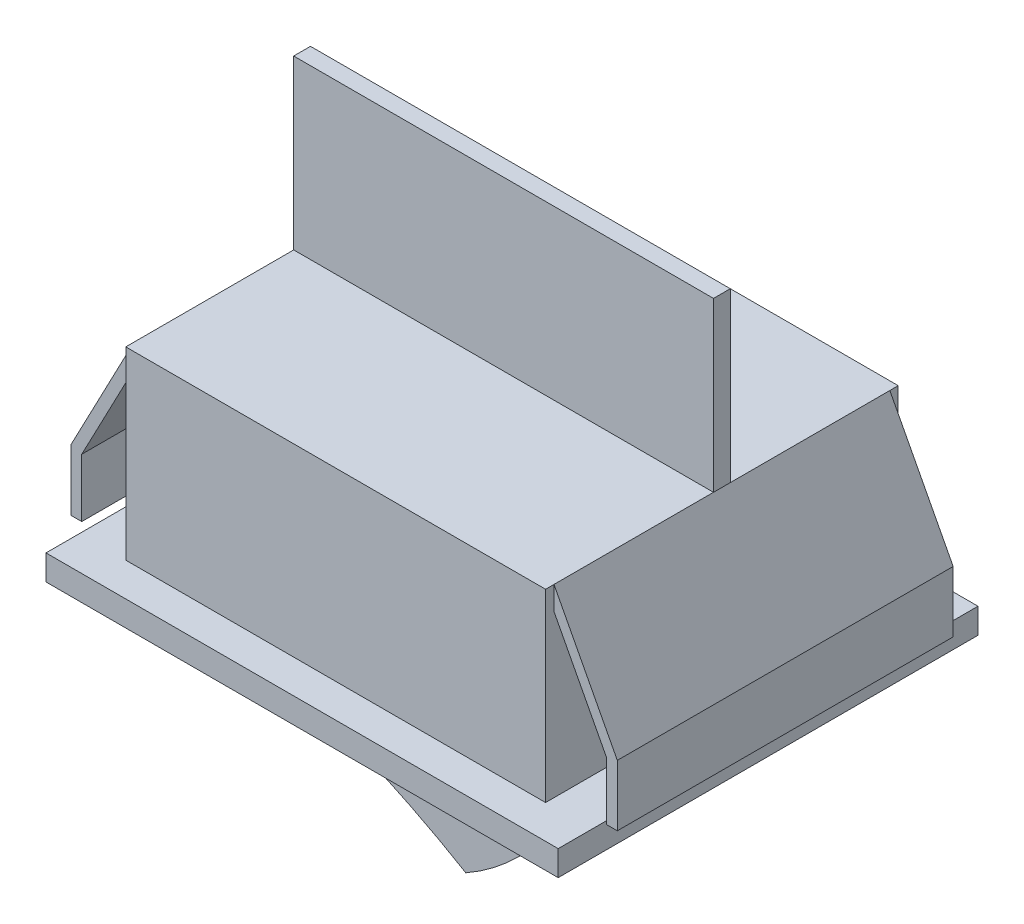
from build123d import *

# Parameters (mm, degrees)
SKETCH1_W                = 25
SKETCH1_H                = 21
BOSS_EXTRUDE1_DEPTH      = 11
SKETCH2_W                = 25
SKETCH2_H                = 1
BOSS_EXTRUDE2_DEPTH      = 10
BOSS_EXTRUDE3_DEPTH      = 10
SKETCH4_W                = 30.5
SKETCH4_H                = 25
BOSS_EXTRUDE4_DEPTH      = 1.5
BOSS_EXTRUDE5_DEPTH      = 8.5
BOSS_EXTRUDE5_DEPTH_BACK = 8.5


with BuildPart() as part:
    # Sketch1 → Boss-Extrude1 (new body)
    with BuildSketch(Plane(origin=(0, 0, 0), x_dir=(1, 0, 0), z_dir=(0, 1, 0))):
        Rectangle(SKETCH1_W, SKETCH1_H)
    extrude(amount=BOSS_EXTRUDE1_DEPTH)

    # Sketch2 → Boss-Extrude2 (add)
    with BuildSketch(Plane(origin=(0, 11, 0), x_dir=(1, 0, 0), z_dir=(0, 1, 0))):
        Rectangle(SKETCH2_W, SKETCH2_H)
    extrude(amount=BOSS_EXTRUDE2_DEPTH)

    # Sketch3 → Boss-Extrude3 (add, symmetric)
    with BuildSketch(Plane.XY):
        Polygon((-12.5, 11), (-16.271420935, 3.81152577), (-16.271420935, 0.178717712), (-15.621420935, 0.178717712), (-15.621420935, 3.651367103), (-12.5, 9.600916182), align=None)
    boss_extrude3 = extrude(amount=BOSS_EXTRUDE3_DEPTH, both=True)

    # Mirror1: Boss-Extrude3 across plane
    add(boss_extrude3.mirror(Plane(origin=(0, 0, 0), x_dir=(0, 0, 1), z_dir=(1, 0, 0))))

    # Sketch4 → Boss-Extrude4 (add)
    with BuildSketch(Plane.XZ):
        Rectangle(SKETCH4_W, SKETCH4_H)
    extrude(amount=BOSS_EXTRUDE4_DEPTH)

    # Sketch5 → Boss-Extrude5 (add, two sides: drawn at the far end of the back side and taken through both)
    with BuildSketch(Plane.XY.offset(-BOSS_EXTRUDE5_DEPTH_BACK)):
        with BuildLine():
            Line((11.75, -1.5), (-11.75, -1.5))
            ThreePointArc((-11.75, -1.5), (-2.707390064, -3.962204019), (5.75, -8))
            ThreePointArc((5.75, -8), (9.254540353, -5.215729557), (11.75, -1.5))
        make_face()
    extrude(amount=BOSS_EXTRUDE5_DEPTH + BOSS_EXTRUDE5_DEPTH_BACK)


solid = part.part
